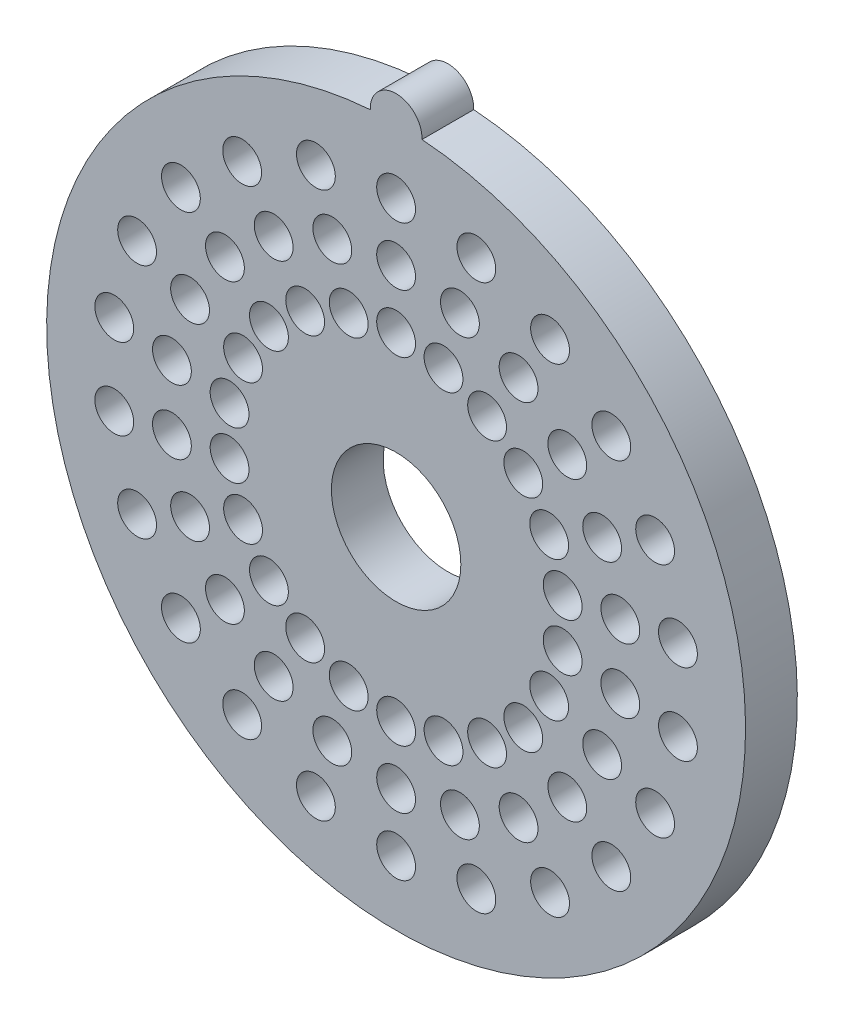
from build123d import *

# Parameters (mm, degrees)
SKETCH1_R           = 5
BOSS_EXTRUDE1_DEPTH = 4
SKETCH2_R           = 1.5
CUT_EXTRUDE1_DEPTH  = 40.824615503
CIRPATTERN1_COUNT   = 22


with BuildPart() as part:
    # Sketch1 → Boss-Extrude1 (new body)
    with BuildSketch(Plane.XY):
        with BuildLine():
            ThreePointArc((-1.998627787, 26.925925926), (0, -27), (1.998627787, 26.925925926))
            ThreePointArc((1.998627787, 26.925925926), (0, 29), (-1.998627787, 26.925925926))
        make_face()
        Circle(SKETCH1_R, mode=Mode.SUBTRACT)
    extrude(amount=BOSS_EXTRUDE1_DEPTH)

    # Sketch2 → Cut-Extrude1 (cut, through all)
    with BuildSketch(Plane.XY.offset(4)):
        with Locations((0, 13)):
            Circle(SKETCH2_R)
        with Locations((0, 17.5)):
            Circle(SKETCH2_R)
        with Locations((0, 22)):
            Circle(SKETCH2_R)
    cut_extrude1 = extrude(amount=-CUT_EXTRUDE1_DEPTH, mode=Mode.SUBTRACT)

    # CirPattern1: Cut-Extrude1 ×22 about axis
    cirpattern1_axis = Axis((0, 0, 0), (0, 0, 1))
    for i in range(1, CIRPATTERN1_COUNT):
        add(cut_extrude1.rotate(cirpattern1_axis, i * 360 / CIRPATTERN1_COUNT), mode=Mode.SUBTRACT)


solid = part.part
